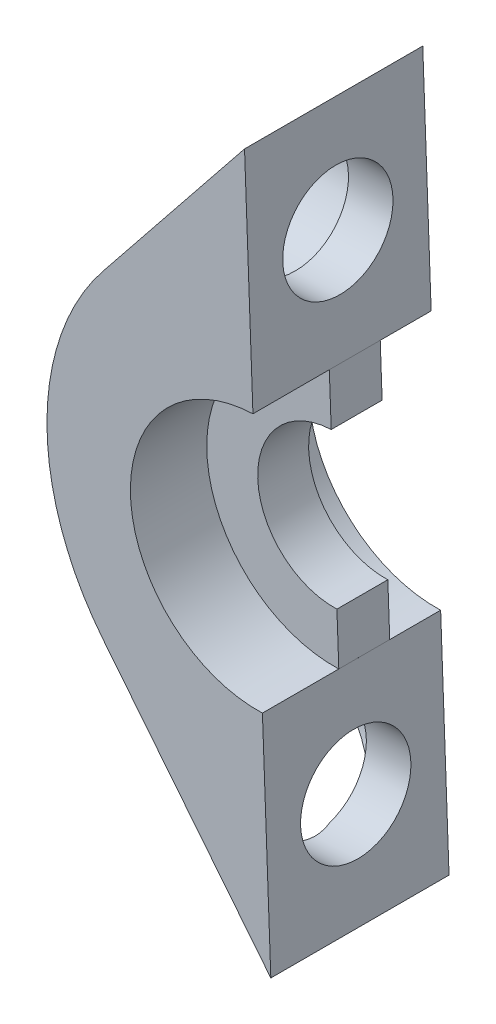
from build123d import *

# Parameters (mm, degrees)
BOSS_EXTRUDE2_DEPTH = 7
BOSS_EXTRUDE3_START = -2
BOSS_EXTRUDE3_DEPTH = 2
CUT_EXTRUDE1_REACH  = 20.032
SKETCH4_R           = 2.165
SKETCH6_R           = 3
CUT_EXTRUDE2_DEPTH  = 2.25


with BuildPart() as part:
    # Sketch2 → Boss-Extrude2 (new body)
    with BuildSketch(Plane.XY):
        with BuildLine():
            Line((-1.537034244, -5.640729849), (-1.207226003, -14.487186411))
            Line((-1.207226003, -14.487186411), (-7.804400539, -6.252306152))
            ThreePointArc((-7.804400539, -6.252306152), (-10, 0), (-7.804400539, 6.252306152))
            Line((-7.804400539, 6.252306152), (-2.239666493, 13.198449277))
            Line((-2.239666493, 13.198449277), (-1.909690796, 4.352324093))
            ThreePointArc((-1.909690796, 4.352324093), (-6.719838781, -0.830529263), (-1.537034244, -5.640729849))
        make_face()
    extrude(amount=BOSS_EXTRUDE2_DEPTH)

    # Sketch3 → Boss-Extrude3 (add)
    with BuildSketch(Plane.XY.offset(4).offset(BOSS_EXTRUDE3_START)):
        with BuildLine():
            Line((-1.909780577, 4.352320743), (-1.835249267, 2.353709953))
            ThreePointArc((-1.835249267, 2.353709953), (-4.721227993, -0.755997952), (-1.611655337, -3.642122406))
            Line((-1.611655337, -3.642122406), (-1.537124027, -5.640733196))
            ThreePointArc((-1.537124027, -5.640733196), (-6.719838781, -0.830529263), (-1.909780577, 4.352320743))
        make_face()
    extrude(amount=BOSS_EXTRUDE3_DEPTH)

    # Sketch4 → Cut-Extrude1 (cut, up to next)
    with BuildSketch(Plane(origin=(-1.744913711, -0.065088285, 0), x_dir=(0, 0, -1), z_dir=(0.9993050159682331, 0.03727579725142651, 0)), mode=Mode.PRIVATE) as cut_extrude1_sk1:
        with Locations(Location((-3.5, 8.846623232, 0), (0, 0, 90))):
            Circle(SKETCH4_R)
    cut_extrude1_tool1 = extrude(cut_extrude1_sk1.sketch, amount=-CUT_EXTRUDE1_REACH, mode=Mode.PRIVATE) & part.part
    # Sketch4 → Cut-Extrude1 (cut, up to next)
    with BuildSketch(Plane(origin=(-1.744913711, -0.065088285, 0), x_dir=(0, 0, -1), z_dir=(0.9993050159682331, 0.03727579725142651, 0)), mode=Mode.PRIVATE) as cut_extrude1_sk2:
        with Locations(Location((-3.5, -10.005816596, 0), (0, 0, 90))):
            Circle(SKETCH4_R)
    cut_extrude1_tool2 = extrude(cut_extrude1_sk2.sketch, amount=-CUT_EXTRUDE1_REACH, mode=Mode.PRIVATE) & part.part
    add(cut_extrude1_tool1.solids().sort_by_distance((-2.074679, 8.775387, 3.5))[0], mode=Mode.SUBTRACT)
    add(cut_extrude1_tool2.solids().sort_by_distance((-1.371939, -10.063951, 3.5))[0], mode=Mode.SUBTRACT)

    # Sketch6 → Cut-Extrude2 (cut, symmetric)
    with BuildSketch(Plane(origin=(-5.742133775, -0.214191474, 0), x_dir=(0, 0, 1), z_dir=(-0.9993050159682331, -0.03727579725142651, 0))):
        with Locations((3.5, -10.005816596)):
            Circle(SKETCH6_R)
        with Locations((3.5, 8.846623232)):
            Circle(SKETCH6_R)
    extrude(amount=CUT_EXTRUDE2_DEPTH, both=True, mode=Mode.SUBTRACT)


solid = part.part
